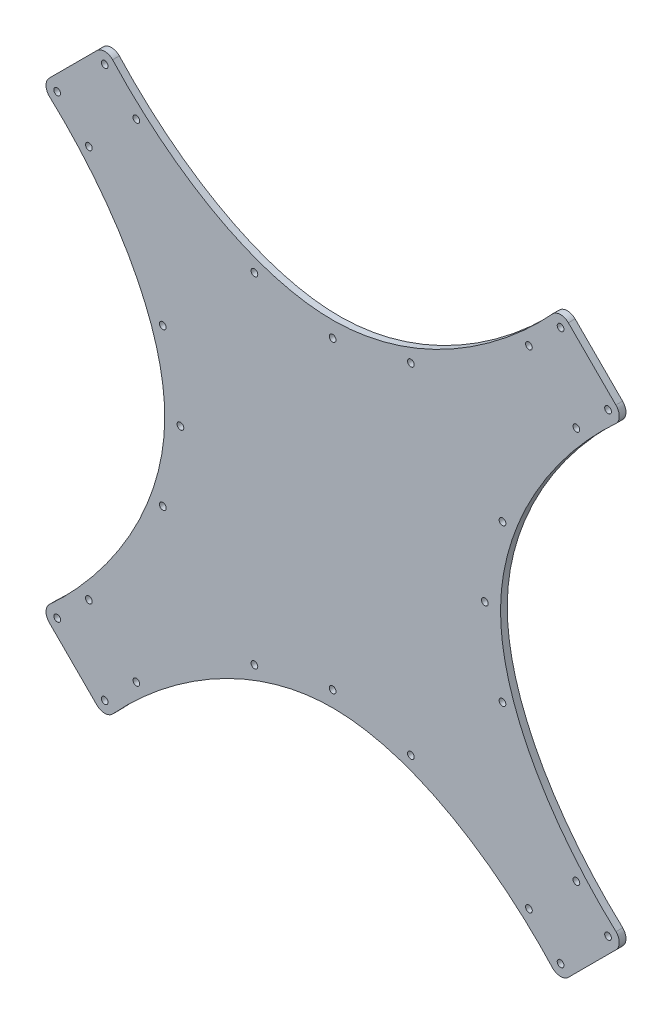
from build123d import *

# Parameters (mm, degrees)
SKETCH1_R           = 1.5
BOSS_EXTRUDE2_DEPTH = 3


with BuildPart() as part:
    # Sketch1 → Boss-Extrude2 (new body)
    with BuildSketch(Plane.XY):
        with BuildLine():
            Line((-70.814700779, 145.910525624), (-49.601497343, 167.12372906))
            ThreePointArc((-49.601497343, 167.12372906), (-46.065963437, 168.588195154), (-42.530429531, 167.12372906))
            add(Edge.make_bspline(
                [(-42.530429531, 167.12372906), (-18.276788233, 140.587500568), (55.757413054, 90.515729887), (129.791614341, 140.587500568), (154.045255639, 167.12372906)],
                knots=[0, 0, 0, 0, 0.5, 1, 1, 1, 1], degree=3))
            ThreePointArc((154.045255639, 167.12372906), (157.547403451, 168.588083689), (161.068794171, 167.170627808))
            Line((161.068794171, 167.170627808), (182.281997607, 145.957424373))
            ThreePointArc((182.281997607, 145.957424373), (183.793881516, 142.408377812), (182.329526886, 138.839457812))
            add(Edge.make_bspline(
                [(182.329526886, -57.736227358), (155.793298394, -33.48258606), (105.721527713, 40.551615227), (155.793298394, 114.585816515), (182.329526886, 138.839457812)],
                knots=[0, 0, 0, 0, 0.5, 1, 1, 1, 1], degree=3))
            ThreePointArc((182.329526886, -57.736227358), (183.79399298, -61.271761264), (182.329526886, -64.807295169))
            Line((182.329526886, -64.807295169), (161.116323451, -86.020498605))
            ThreePointArc((161.116323451, -86.020498605), (157.580789545, -87.484964699), (154.045255639, -86.020498605))
            add(Edge.make_bspline(
                [(-42.530429531, -86.020498605), (-18.276788233, -59.484270113), (55.757413054, -9.412499432), (129.791614341, -59.484270113), (154.045255639, -86.020498605)],
                knots=[0, 0, 0, 0, 0.5, 1, 1, 1, 1], degree=3))
            ThreePointArc((-42.530429531, -86.020498605), (-46.065963437, -87.484964699), (-49.601497343, -86.020498605))
            Line((-49.601497343, -86.020498605), (-70.814700779, -64.807295169))
            ThreePointArc((-70.814700779, -64.807295169), (-72.279166873, -61.271761264), (-70.814700779, -57.736227358))
            add(Edge.make_bspline(
                [(-70.814700779, 138.839457812), (-44.278472287, 114.585816515), (5.793298394, 40.551615227), (-44.278472287, -33.48258606), (-70.814700779, -57.736227358)],
                knots=[0, 0, 0, 0, 0.5, 1, 1, 1, 1], degree=3))
            ThreePointArc((-70.814700779, 138.839457812), (-72.279166873, 142.374991718), (-70.814700779, 145.910525624))
        make_face()
        with Locations((-12.242586946, 40.551615227)):
            Circle(SKETCH1_R, mode=Mode.SUBTRACT)
        with Locations((55.757413054, 108.551615227)):
            Circle(SKETCH1_R, mode=Mode.SUBTRACT)
        with Locations((123.757413054, 40.551615227)):
            Circle(SKETCH1_R, mode=Mode.SUBTRACT)
        with Locations((55.757413054, -27.448384773)):
            Circle(SKETCH1_R, mode=Mode.SUBTRACT)
        with Locations((131.632800586, 75.501362696)):
            Circle(SKETCH1_R, mode=Mode.SUBTRACT)
        with Locations((131.632800586, 5.601867759)):
            Circle(SKETCH1_R, mode=Mode.SUBTRACT)
        with Locations((20.807665586, 116.427002759)):
            Circle(SKETCH1_R, mode=Mode.SUBTRACT)
        with Locations((90.707160522, 116.427002759)):
            Circle(SKETCH1_R, mode=Mode.SUBTRACT)
        with Locations((-20.117974478, 75.501362696)):
            Circle(SKETCH1_R, mode=Mode.SUBTRACT)
        with Locations((-20.117974478, 5.601867759)):
            Circle(SKETCH1_R, mode=Mode.SUBTRACT)
        with Locations((20.807665586, -35.323772305)):
            Circle(SKETCH1_R, mode=Mode.SUBTRACT)
        with Locations((90.707160522, -35.323772305)):
            Circle(SKETCH1_R, mode=Mode.SUBTRACT)
        with Locations((-67.279166873, 142.374991718)):
            Circle(SKETCH1_R, mode=Mode.SUBTRACT)
        with Locations((-46.065963437, 163.588195154)):
            Circle(SKETCH1_R, mode=Mode.SUBTRACT)
        with Locations((157.580789545, 163.588195154)):
            Circle(SKETCH1_R, mode=Mode.SUBTRACT)
        with Locations((157.580789545, -82.484964699)):
            Circle(SKETCH1_R, mode=Mode.SUBTRACT)
        with Locations((178.79399298, -61.271761264)):
            Circle(SKETCH1_R, mode=Mode.SUBTRACT)
        with Locations((-67.279166873, -61.271761264)):
            Circle(SKETCH1_R, mode=Mode.SUBTRACT)
        with Locations((-46.065963437, -82.484964699)):
            Circle(SKETCH1_R, mode=Mode.SUBTRACT)
        with Locations((178.79399298, 142.374991718)):
            Circle(SKETCH1_R, mode=Mode.SUBTRACT)
        with Locations((-53.137031249, 128.232856094)):
            Circle(SKETCH1_R, mode=Mode.SUBTRACT)
        with Locations((-31.923827813, 149.44605953)):
            Circle(SKETCH1_R, mode=Mode.SUBTRACT)
        with Locations((143.438653921, 149.44605953)):
            Circle(SKETCH1_R, mode=Mode.SUBTRACT)
        with Locations((164.651857357, 128.232856094)):
            Circle(SKETCH1_R, mode=Mode.SUBTRACT)
        with Locations((143.438653921, -68.342829075)):
            Circle(SKETCH1_R, mode=Mode.SUBTRACT)
        with Locations((164.651857357, -47.12962564)):
            Circle(SKETCH1_R, mode=Mode.SUBTRACT)
        with Locations((-53.137031249, -47.12962564)):
            Circle(SKETCH1_R, mode=Mode.SUBTRACT)
        with Locations((-31.923827813, -68.342829075)):
            Circle(SKETCH1_R, mode=Mode.SUBTRACT)
    extrude(amount=BOSS_EXTRUDE2_DEPTH)


solid = part.part
